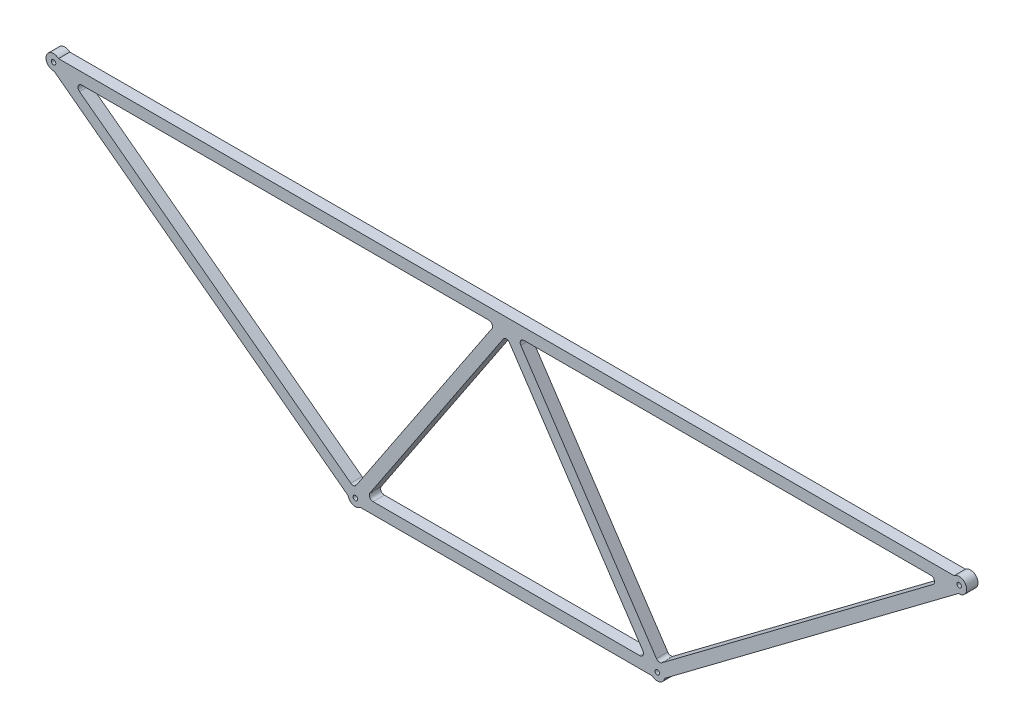
from build123d import *
from build123d.topology import SkipClean

# Parameters (mm, degrees)
SKETCH1_R             = 10
SKETCH1_R_2           = 3
BOSS_EXTRUDE1_DEPTH   = 7.5
BOSS_EXTRUDE1_2_DEPTH = 7.5
BOSS_EXTRUDE1_3_DEPTH = 7.5
BOSS_EXTRUDE1_4_DEPTH = 7.5
BOSS_EXTRUDE2_DEPTH   = 7.5
SKETCH3_R             = 3
CUT_EXTRUDE1_DEPTH    = 15
FILLET1_R             = 5


with BuildPart() as part:
    # Sketch1 → Boss-Extrude1 (new, symmetric)
    with BuildSketch(Plane.XY):
        with Locations((-600, 0)):
            Circle(SKETCH1_R)
        with Locations((-600, 0)):
            Circle(SKETCH1_R_2, mode=Mode.SUBTRACT)
    extrude(amount=BOSS_EXTRUDE1_DEPTH, both=True)



with BuildPart() as body_2:
    # Sketch1 → Boss-Extrude1 2 (new, symmetric)
    with BuildSketch(Plane.XY):
        with Locations((-200, -300)):
            Circle(SKETCH1_R)
        with Locations((-200, -300)):
            Circle(SKETCH1_R_2, mode=Mode.SUBTRACT)
    extrude(amount=BOSS_EXTRUDE1_2_DEPTH, both=True)


with BuildPart() as body_3:
    # Sketch1 → Boss-Extrude1 3 (new, symmetric)
    with BuildSketch(Plane.XY):
        with Locations((200, -300)):
            Circle(SKETCH1_R)
        with Locations((200, -300)):
            Circle(SKETCH1_R_2, mode=Mode.SUBTRACT)
    extrude(amount=BOSS_EXTRUDE1_3_DEPTH, both=True)


with BuildPart() as body_4:
    # Sketch1 → Boss-Extrude1 4 (new, symmetric)
    with BuildSketch(Plane.XY):
        with Locations((600, 0)):
            Circle(SKETCH1_R)
        with Locations((600, 0)):
            Circle(SKETCH1_R_2, mode=Mode.SUBTRACT)
    extrude(amount=BOSS_EXTRUDE1_4_DEPTH, both=True)


with BuildPart() as part_1:
    add(part.part)

    add(body_2.part)  # Boss-Extrude2 merges body 2

    add(body_3.part)  # Boss-Extrude2 merges body 3

    add(body_4.part)  # Boss-Extrude2 merges body 4
    # Sketch2 → Boss-Extrude2 (add, symmetric)
    with BuildSketch(Plane.XY):
        Polygon((200, -307.5), (202.5, -307.5), (204.5, -306), (622.5, 7.5), (-622.5, 7.5), (-204.5, -306), (-202.5, -307.5), (-200, -307.5), align=None)
        Polygon((201.842585459, -289.243060906), (577.5, -7.5), (14.013878189, -7.5), align=None, mode=Mode.SUBTRACT)
        Polygon((-577.5, -7.5), (-201.842585459, -289.243060906), (-14.013878189, -7.5), align=None, mode=Mode.SUBTRACT)
        Polygon((-185.986121811, -292.5), (185.986121811, -292.5), (0, -13.520817283), align=None, mode=Mode.SUBTRACT)
    extrude(amount=BOSS_EXTRUDE2_DEPTH, both=True)

    # Sketch3 → Cut-Extrude1 (cut, symmetric)
    with SkipClean():  # the faces are left unmerged after this step: merging them gives an invalid solid
        with BuildSketch(Plane.XY):
            with Locations((-600, 0)):
                Circle(SKETCH3_R)
            with Locations((-200, -300)):
                Circle(SKETCH3_R)
            with Locations((200, -300)):
                Circle(SKETCH3_R)
            with Locations((600, 0)):
                Circle(SKETCH3_R)
            with BuildLine():
                Line((605.772412725, 8.165736423), (623.676739049, 10.899071484))
                Line((623.676739049, 10.899071484), (625.286418453, -4.2155453))
                Line((625.286418453, -4.2155453), (609.468772967, -3.215950638))
                ThreePointArc((609.468772967, -3.215950638), (609.511000758, 3.088829), (605.772412725, 8.165736423))
            make_face()
            with BuildLine():
                Line((-625.286418453, -4.2155453), (-609.468772967, -3.215950638))
                ThreePointArc((-609.468772967, -3.215950638), (-609.511000758, 3.088829), (-605.772412725, 8.165736423))
                Line((-605.772412725, 8.165736423), (-623.676739049, 10.899071484))
                Line((-623.676739049, 10.899071484), (-625.286418453, -4.2155453))
            make_face()
        extrude(amount=CUT_EXTRUDE1_DEPTH, both=True, mode=Mode.SUBTRACT)

    # Fillet1
    fillet1_edges = [part_1.edges().sort_by_distance(p)[0] for p in [
        (0, -13.520817283, 0),
        (-185.986121811, -292.5, 0),
        (185.986121811, -292.5, 0),
        (14.013878189, -7.5, 0),
        (201.842585459, -289.243060906, 0),
        (577.5, -7.5, 0),
        (-577.5, -7.5, 0),
        (-201.842585459, -289.243060906, 0),
        (-14.013878189, -7.5, 0),
    ]]
    fillet(fillet1_edges, radius=FILLET1_R)


solid = part_1.part
